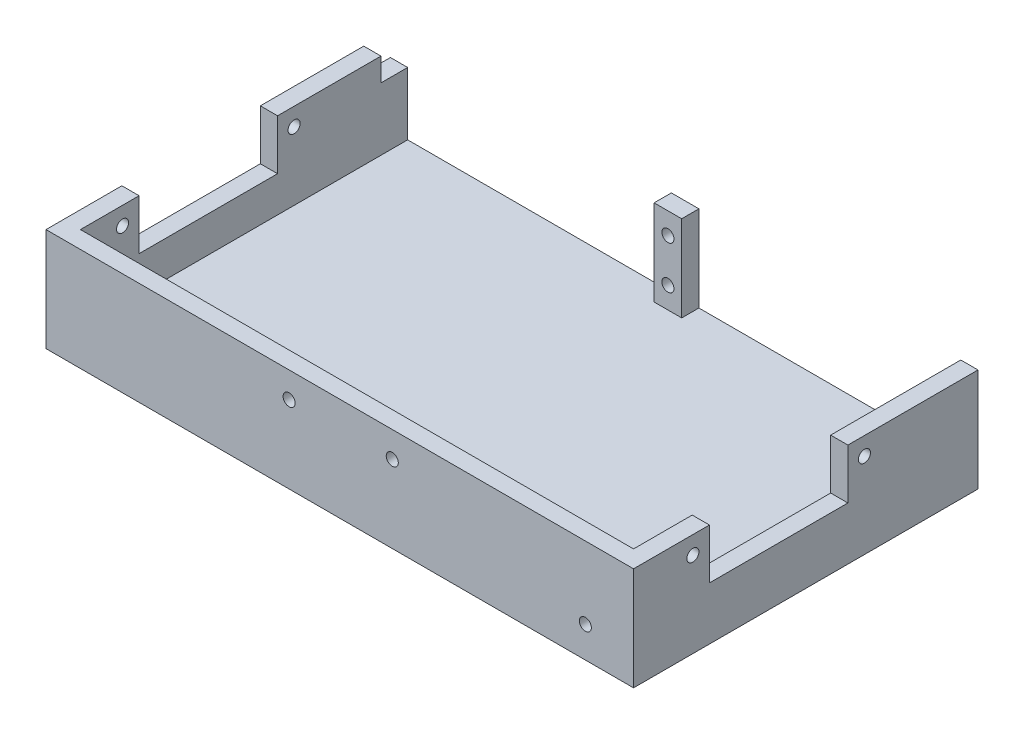
from build123d import *

# Parameters (mm, degrees)
SKETCH3_W           = 170.58
SKETCH3_H           = 100
BOSS_EXTRUDE1_DEPTH = 5
SKETCH4_W           = 5
SKETCH4_H           = 100
BOSS_EXTRUDE2_DEPTH = 24.94
SKETCH6_W           = 160.58
SKETCH6_H           = 5
BOSS_EXTRUDE3_DEPTH = 24.94
BOSS_EXTRUDE4_DEPTH = 24.94
SKETCH8_R           = 1.75
CUT_EXTRUDE1_DEPTH  = 8
SKETCH9_W           = 7.75
SKETCH9_H           = 6.74
CUT_EXTRUDE2_DEPTH  = 10
SKETCH12_W          = 40.2
SKETCH12_H          = 14.565
CUT_EXTRUDE4_DEPTH  = 200
SKETCH13_R          = 1.75
CUT_EXTRUDE5_DEPTH  = 200
SKETCH14_R          = 1.75
CUT_EXTRUDE6_DEPTH  = 10


with BuildPart() as part:
    # Sketch3 → Boss-Extrude1 (new body)
    with BuildSketch(Plane(origin=(0, 0, 0), x_dir=(1, 0, 0), z_dir=(0, 1, 0))):
        with Locations((6.45008576, -36.464595487)):
            Rectangle(SKETCH3_W, SKETCH3_H)
    extrude(amount=BOSS_EXTRUDE1_DEPTH)

    # Sketch4 → Boss-Extrude2 (add)
    with BuildSketch(Plane(origin=(0, 5, 0), x_dir=(1, 0, 0), z_dir=(0, 1, 0))):
        with Locations((89.24008576, -36.464595487)):
            Rectangle(SKETCH4_W, SKETCH4_H)
        with Locations((-76.33991424, -36.464595487)):
            Rectangle(SKETCH4_W, SKETCH4_H)
    extrude(amount=BOSS_EXTRUDE2_DEPTH)

    # Sketch6 → Boss-Extrude3 (add)
    with BuildSketch(Plane(origin=(0, 5, 0), x_dir=(1, 0, 0), z_dir=(0, 1, 0))):
        with Locations((6.45008576, -83.964595487)):
            Rectangle(SKETCH6_W, SKETCH6_H)
    extrude(amount=BOSS_EXTRUDE3_DEPTH)

    # Sketch7 → Boss-Extrude4 (add)
    with BuildSketch(Plane(origin=(0, 5, 0), x_dir=(1, 0, 0), z_dir=(0, 1, 0))):
        Polygon((6.45008576, 13.535404513), (2.715085759, 13.535404513), (2.715085759, 8.535404513), (10.715085759, 8.535404513), (10.715085759, 13.535404513), align=None)
    extrude(amount=BOSS_EXTRUDE4_DEPTH)

    # Sketch8 → Cut-Extrude1 (cut)
    with BuildSketch(Plane.XY.offset(-8.535404513)):
        with Locations((6.715085759, 11.235)):
            Circle(SKETCH8_R)
        with Locations((6.715085759, 23.705)):
            Circle(SKETCH8_R)
    extrude(amount=-CUT_EXTRUDE1_DEPTH, mode=Mode.SUBTRACT)

    # Sketch9 → Cut-Extrude2 (cut)
    with BuildSketch(Plane.ZY.offset(78.83991424)):
        with Locations((-9.660404513, 26.57)):
            Rectangle(SKETCH9_W, SKETCH9_H)
    extrude(amount=-CUT_EXTRUDE2_DEPTH, mode=Mode.SUBTRACT)

    # Sketch12 → Cut-Extrude4 (cut)
    with BuildSketch(Plane.ZY.offset(78.83991424)):
        with Locations((44.339595487, 22.6575)):
            Rectangle(SKETCH12_W, SKETCH12_H)
    extrude(amount=-CUT_EXTRUDE4_DEPTH, mode=Mode.SUBTRACT)

    # Sketch13 → Cut-Extrude5 (cut)
    with BuildSketch(Plane.ZY.offset(78.83991424)):
        with Locations((69.23959554, 24.75)):
            Circle(SKETCH13_R)
        with Locations((19.43959554, 24.75)):
            Circle(SKETCH13_R)
    extrude(amount=-CUT_EXTRUDE5_DEPTH, mode=Mode.SUBTRACT)

    # Sketch14 → Cut-Extrude6 (cut)
    with BuildSketch(Plane.XY.offset(86.464595487)):
        with Locations((21.687920531, 22.44)):
            Circle(SKETCH14_R)
        with Locations((-8.252079469, 22.44)):
            Circle(SKETCH14_R)
        with Locations((77.74008576, 9)):
            Circle(SKETCH14_R)
    extrude(amount=-CUT_EXTRUDE6_DEPTH, mode=Mode.SUBTRACT)


solid = part.part
